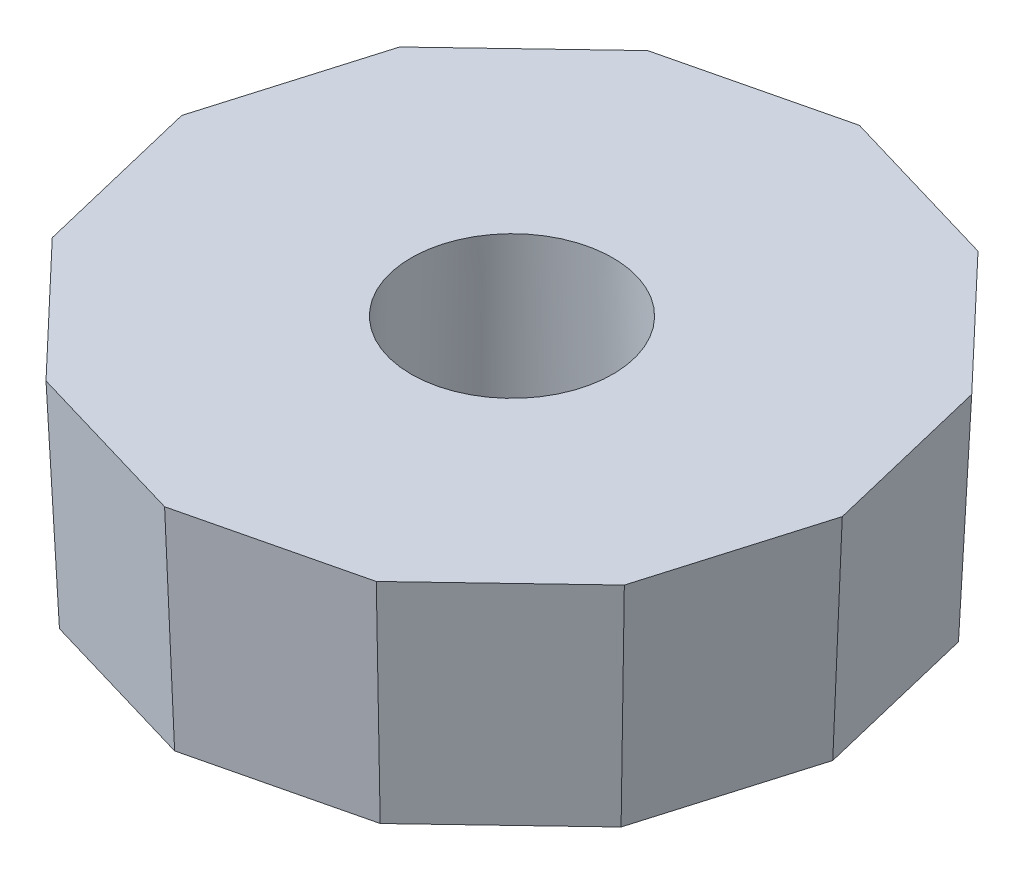
from build123d import *

# Parameters (mm, degrees)
SKETCH1_R           = 3.2385
BOSS_EXTRUDE1_DEPTH = 6.35
BOSS_EXTRUDE1_DRAFT = -2.5


with BuildPart() as part:
    # Sketch1 → Boss-Extrude1 (with draft: the straight prism first)
    with BuildSketch(Plane(origin=(0, 0, 0), x_dir=(1, 0, 0), z_dir=(0, 1, 0))):
        Polygon((8.24563965, -5.042609025), (9.662237919, -0.244207692), (8.489847342, 4.619628895), (5.042609025, 8.24563965), (0.244207692, 9.662237919), (-4.619628895, 8.489847342), (-8.24563965, 5.042609025), (-9.662237919, 0.244207692), (-8.489847342, -4.619628895), (-5.042609025, -8.24563965), (-0.244207692, -9.662237919), (4.619628895, -8.489847342), align=None)
        Circle(SKETCH1_R, mode=Mode.SUBTRACT)
    extrude(amount=BOSS_EXTRUDE1_DEPTH)
    # Boss-Extrude1: the draft: its side faces are tilted about the plane it starts from
    boss_extrude1_sides = [part.faces().sort_by_distance(p)[0] for p in [
        (8.953938785, 3.175, 2.643408358),
        (9.07604263, 3.175, -2.187710601),
        (6.766228183, 3.175, -6.432634272),
        (2.643408358, 3.175, -8.953938785),
        (-2.187710601, 3.175, -9.07604263),
        (-6.432634272, 3.175, -6.766228183),
        (-8.953938785, 3.175, -2.643408358),
        (-9.07604263, 3.175, 2.187710601),
        (-6.766228183, 3.175, 6.432634272),
        (-2.643408358, 3.175, 8.953938785),
        (2.187710601, 3.175, 9.07604263),
        (6.432634272, 3.175, 6.766228183),
        (-3.2385, 3.175, 0),
    ]]
    draft(boss_extrude1_sides, Plane(origin=(0, 0, 0), x_dir=(1, 0, 0), z_dir=(0, 1, 0)), BOSS_EXTRUDE1_DRAFT)


solid = part.part
